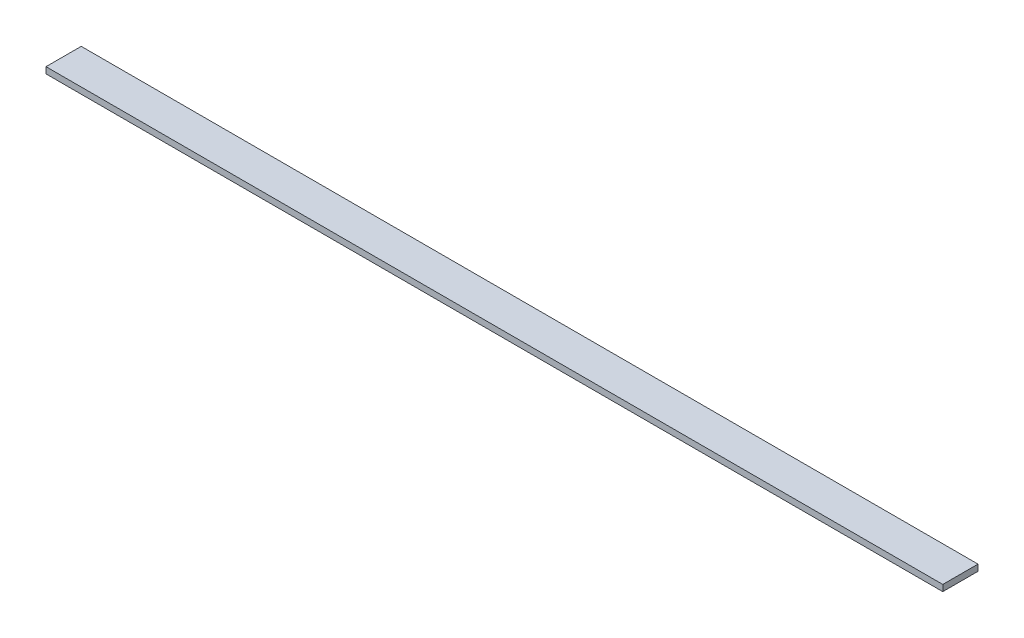
from build123d import *

# Parameters (mm, degrees)
SKETCH1_W           = 914.4
SKETCH1_H           = 35.9
BOSS_EXTRUDE1_DEPTH = 6.4


with BuildPart() as part:
    # Sketch1 → Boss-Extrude1 (new body)
    with BuildSketch(Plane(origin=(0, 0, 0), x_dir=(1, 0, 0), z_dir=(0, 1, 0))):
        Rectangle(SKETCH1_W, SKETCH1_H)
    extrude(amount=BOSS_EXTRUDE1_DEPTH)


solid = part.part
